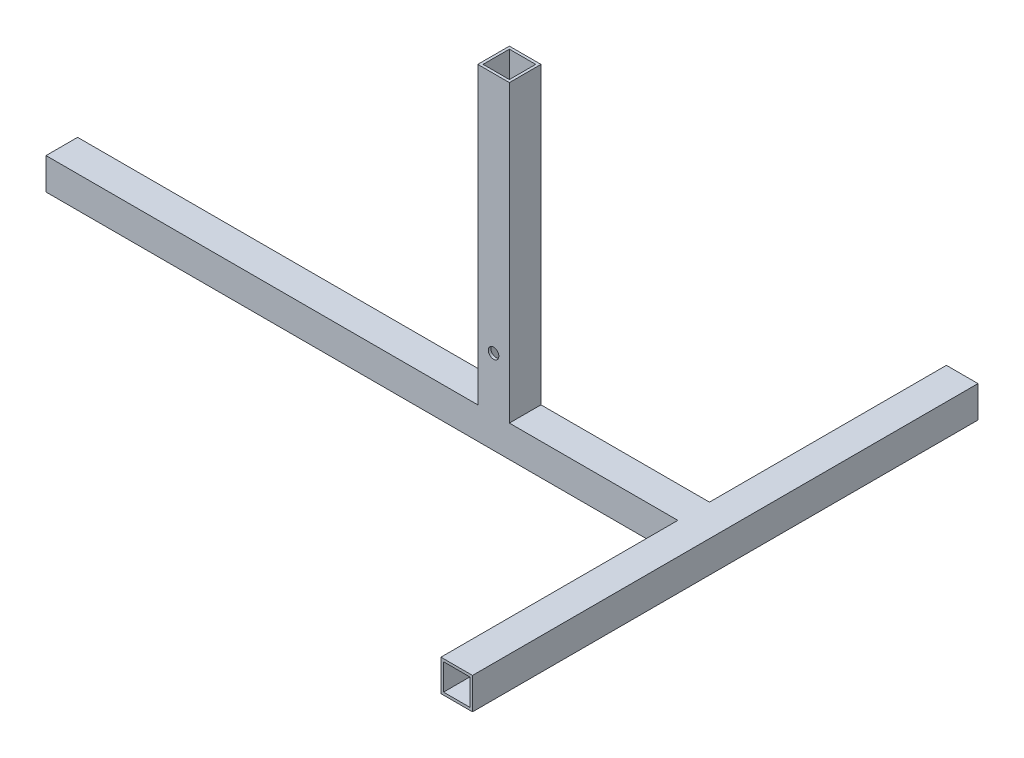
from build123d import *

# Parameters (mm, degrees)
BOSS_EXTRUDE2_DEPTH      = 222.25
BOSS_EXTRUDE2_DEPTH_BACK = 539.75
SKETCH1_W                = 38.1
SKETCH1_H                = 38.1
SKETCH1_W_2              = 31.75
SKETCH1_H_2              = 31.75
SKETCH2_W                = 38.1
SKETCH2_H                = 38.1
SKETCH2_W_2              = 31.75
SKETCH2_H_2              = 31.75
BOSS_EXTRUDE3_DEPTH      = 355.6
SKETCH3_W                = 38.1
SKETCH3_H                = 38.1
SKETCH3_W_2              = 31.75
SKETCH3_H_2              = 31.75
BOSS_EXTRUDE4_DEPTH      = 304.8
SKETCH4_R                = 6.35
CUT_EXTRUDE1_DEPTH       = 743.434222676


with BuildPart() as part:
    # Sketch1 → Boss-Extrude2 (new, two sides: drawn at the far end of the back side and taken through both)
    with BuildSketch(Plane(origin=(0, 0, 0), x_dir=(0, 0, -1), z_dir=(1, 0, 0)).offset(-BOSS_EXTRUDE2_DEPTH_BACK)):
        with Locations((0, 19.05)):
            Rectangle(SKETCH1_W, SKETCH1_H)
        with Locations((0, 19.05)):
            Rectangle(SKETCH1_W_2, SKETCH1_H_2, mode=Mode.SUBTRACT)
    extrude(amount=BOSS_EXTRUDE2_DEPTH + BOSS_EXTRUDE2_DEPTH_BACK)

    # Sketch2 → Boss-Extrude3 (add)
    with BuildSketch(Plane(origin=(0, 38.1, 0), x_dir=(1, 0, 0), z_dir=(0, 1, 0))):
        Rectangle(SKETCH2_W, SKETCH2_H)
        Rectangle(SKETCH2_W_2, SKETCH2_H_2, mode=Mode.SUBTRACT)
    extrude(amount=BOSS_EXTRUDE3_DEPTH)

    # Sketch3 → Boss-Extrude4 (add, symmetric)
    with BuildSketch(Plane.XY):
        with Locations((241.3, 19.05)):
            Rectangle(SKETCH3_W, SKETCH3_H)
        with Locations((241.3, 19.05)):
            Rectangle(SKETCH3_W_2, SKETCH3_H_2, mode=Mode.SUBTRACT)
    extrude(amount=BOSS_EXTRUDE4_DEPTH, both=True)

    # Sketch4 → Cut-Extrude1 (cut, through all)
    with BuildSketch(Plane.XY.offset(19.05)):
        with Locations((0, 101.6)):
            Circle(SKETCH4_R)
    extrude(amount=-CUT_EXTRUDE1_DEPTH, mode=Mode.SUBTRACT)


solid = part.part
